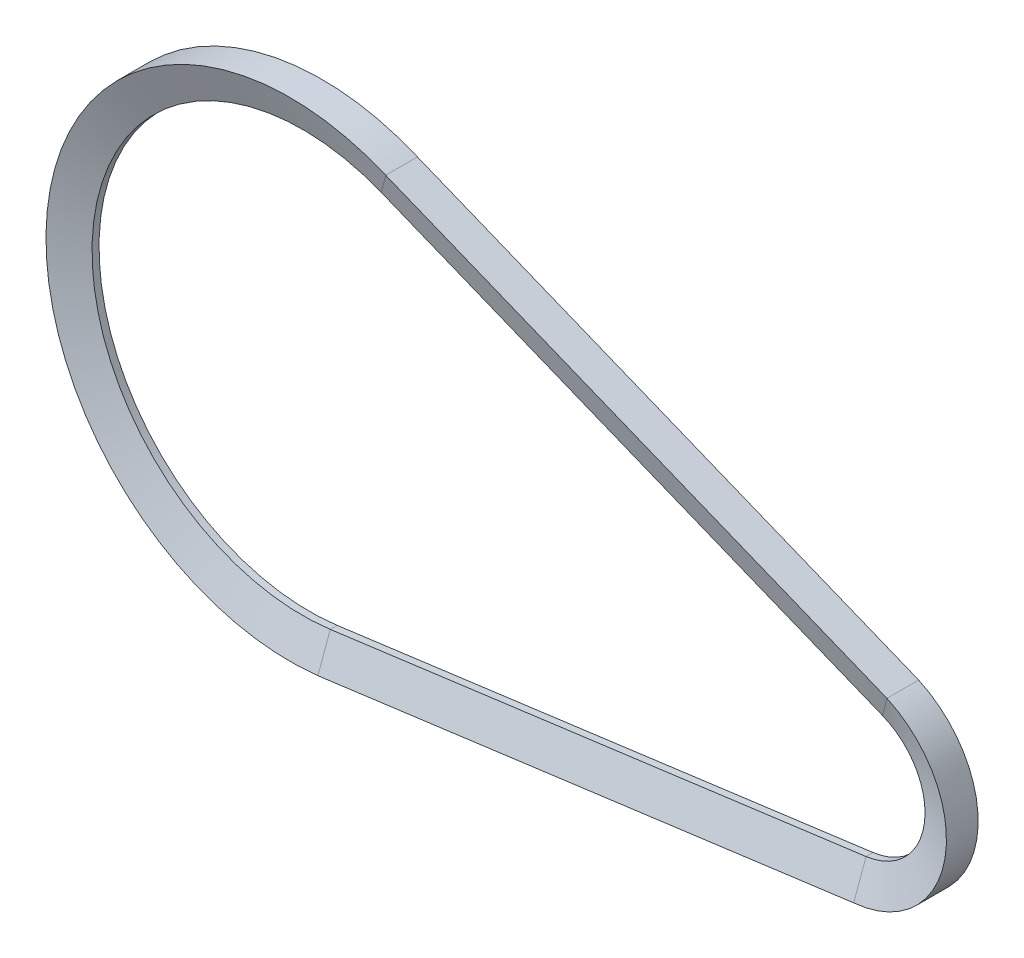
from build123d import *


with BuildPart() as part:
    # Sweep1: sweep along a path in Sketch1
    with BuildLine(Plane.XY) as sweep1_path:
        Line((17.412721367, 43.116668872), (128.117006893, -1.591397138))
        ThreePointArc((128.117006893, -1.591397138), (137.381347861, -17.382946056), (124.475719307, -30.369315156))
        Line((124.475719307, -30.369315156), (6.124729851, -46.094876985))
        ThreePointArc((6.124729851, -46.094876985), (-46.132178368, 5.837132773), (17.412721367, 43.116668872))
    # Sketch2 → Sweep1 (sweep)
    with BuildSketch(Plane.ZY.offset(-6.124729851)):
        Polygon((0.770223243, -46.094876985), (-0.770223243, -46.094876985), (-3.5, -53.594876985), (3.5, -53.594876985), align=None)
    sweep(path=sweep1_path.line)


solid = part.part
